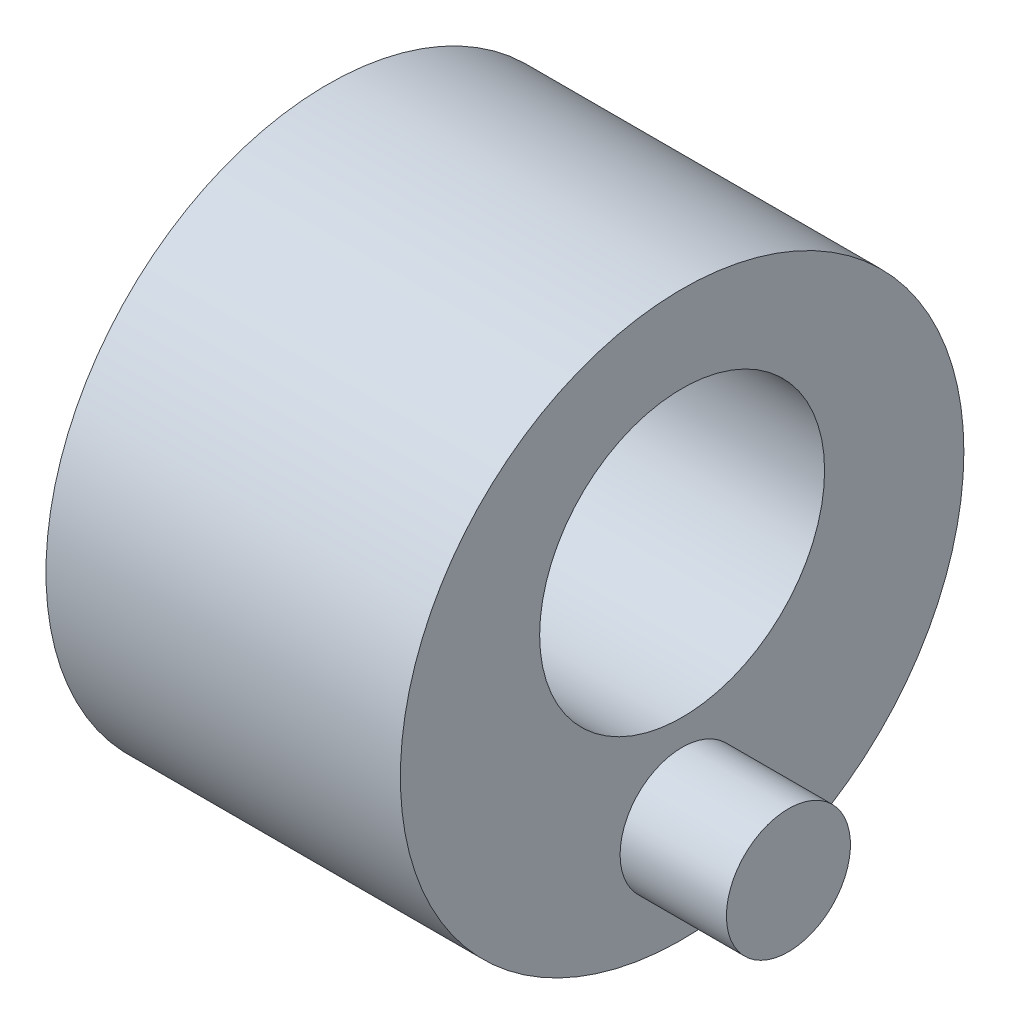
from build123d import *

# Parameters (mm, degrees)
SKETCH1_R           = 100.965
BOSS_EXTRUDE1_DEPTH = 127
SKETCH2_R           = 51.054
CUT_EXTRUDE1_DEPTH  = 192.093857698
SKETCH3_R           = 22.225
BOSS_EXTRUDE2_DEPTH = 38.1


with BuildPart() as part:
    # Sketch1 → Boss-Extrude1 (new body)
    with BuildSketch(Plane(origin=(0, 0, 0), x_dir=(0, 0, -1), z_dir=(1, 0, 0))):
        Circle(SKETCH1_R)
    extrude(amount=-BOSS_EXTRUDE1_DEPTH)

    # Sketch2 → Cut-Extrude1 (cut, through all)
    with BuildSketch(Plane(origin=(0, 0, 0), x_dir=(0, 0, -1), z_dir=(1, 0, 0))):
        with Locations((0, 19.05)):
            Circle(SKETCH2_R)
    extrude(amount=-CUT_EXTRUDE1_DEPTH, mode=Mode.SUBTRACT)

    # Sketch3 → Boss-Extrude2 (add)
    with BuildSketch(Plane(origin=(0, 0, 0), x_dir=(0, 0, -1), z_dir=(1, 0, 0))):
        with Locations(Location((0, -63.5, 0), (0, 0, 180))):
            Circle(SKETCH3_R)
    extrude(amount=BOSS_EXTRUDE2_DEPTH)


solid = part.part
